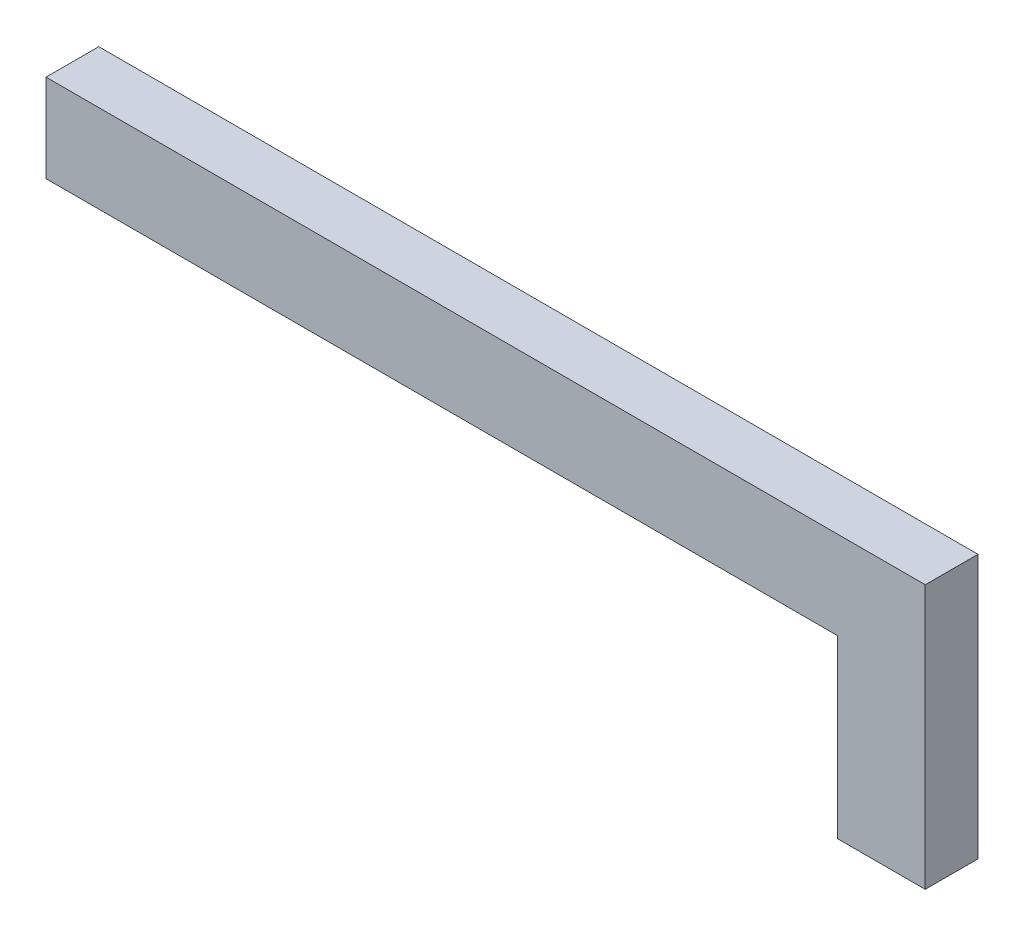
from build123d import *

# Parameters (mm, degrees)
BOSS_EXTRUDE1_DEPTH = 3


with BuildPart() as part:
    # Sketch1 → Boss-Extrude1 (new body)
    with BuildSketch(Plane.XY):
        Polygon((20, -2.5), (-25, -2.5), (-25, 2.5), (25, 2.5), (25, -2.5), (25, -12.5), (20, -12.5), align=None)
    extrude(amount=BOSS_EXTRUDE1_DEPTH)


solid = part.part
